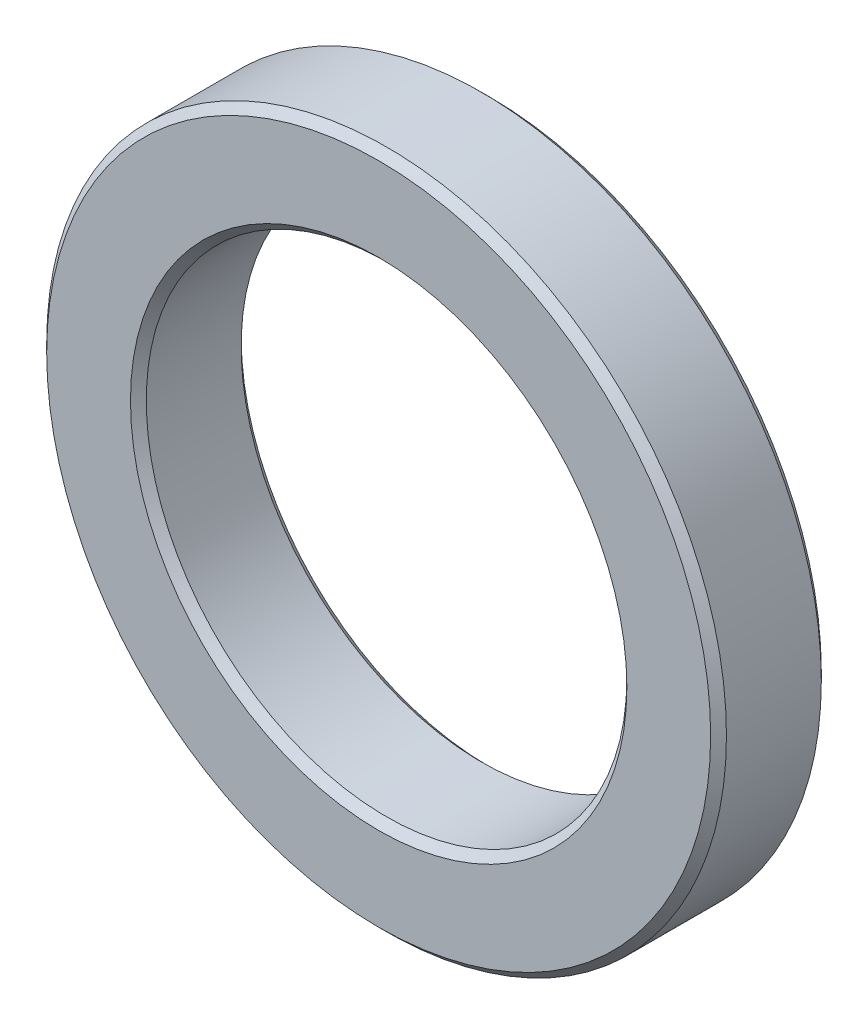
from build123d import *

# Parameters (mm, degrees)
SKETCH_1_R      = 21.5
SKETCH_1_R_2    = 15.2
EXTRUDE_1_DEPTH = 3.5
CHAMFER_1_SIZE  = 0.5


with BuildPart() as part:
    # 草图1 → 凸台-拉伸1 (new, symmetric)
    with BuildSketch(Plane.XY):
        Circle(SKETCH_1_R)
        Circle(SKETCH_1_R_2, mode=Mode.SUBTRACT)
    extrude(amount=EXTRUDE_1_DEPTH, both=True)

    # 倒角1
    chamfer_1_edges = [part.edges().sort_by_distance(p)[0] for p in [
        (-21.5, 0, -3.5),
        (-21.5, 0, 3.5),
        (-15.2, 0, -3.5),
        (-15.2, 0, 3.5),
    ]]
    chamfer(chamfer_1_edges, length=CHAMFER_1_SIZE)


solid = part.part
